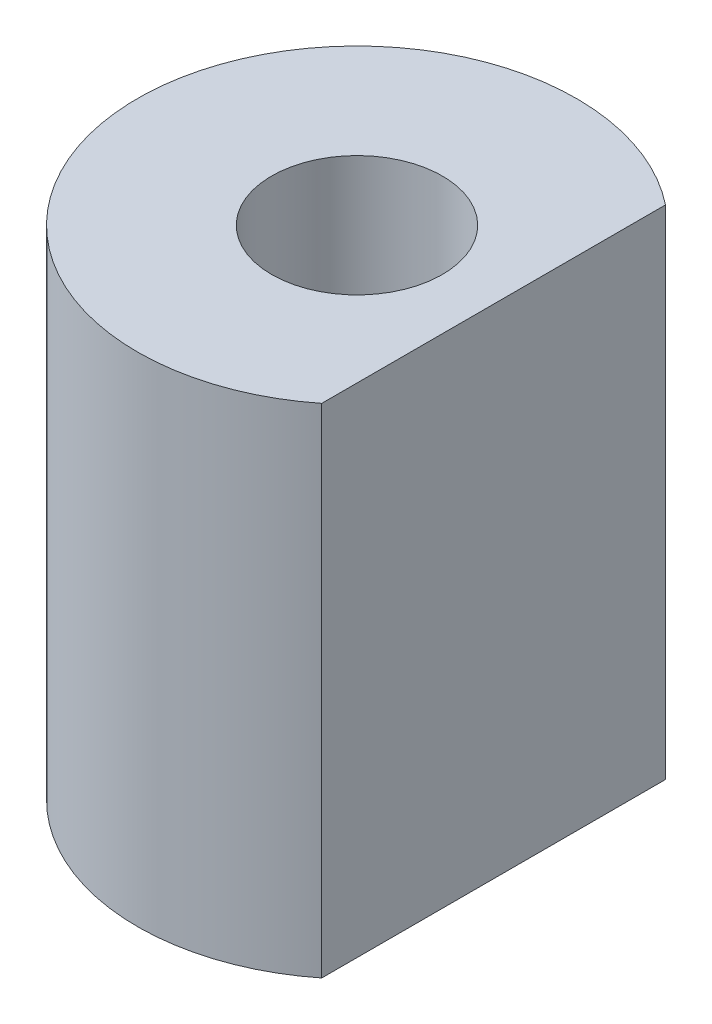
from build123d import *

# Parameters (mm, degrees)
SKETCH_2_R      = 1.75
EXTRUDE_1_DEPTH = 10.2


with BuildPart() as part:
    # 草图2 → 凸台-拉伸1 (new body)
    with BuildSketch(Plane(origin=(0, 0, 0), x_dir=(1, 0, 0), z_dir=(0, 1, 0))):
        with BuildLine():
            Line((2.8, -3.522782991), (2.8, 3.522782991))
            ThreePointArc((2.8, 3.522782991), (-4.5, 0), (2.8, -3.522782991))
        make_face()
        with Locations(Location((0, 0, 0), (0, 0, 270))):
            Circle(SKETCH_2_R, mode=Mode.SUBTRACT)
    extrude(amount=EXTRUDE_1_DEPTH)


solid = part.part
